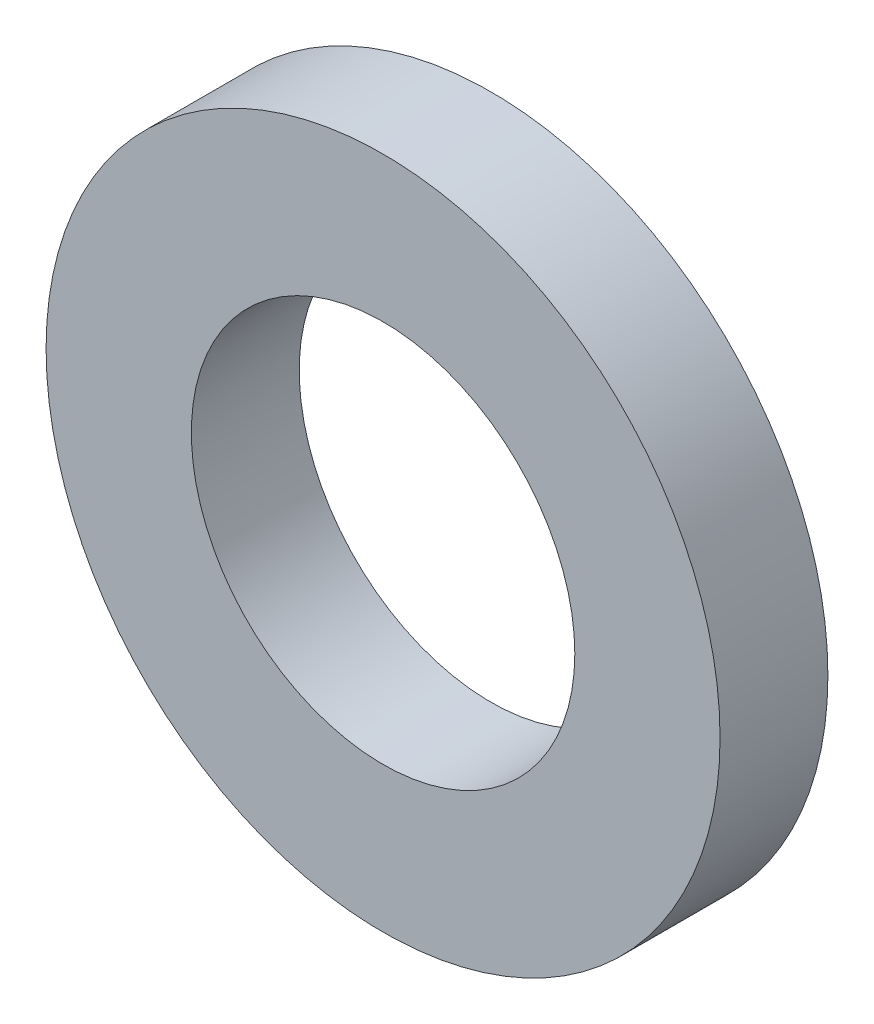
from build123d import *

# Parameters (mm, degrees)
SKETCH1_R           = 3.125
SKETCH1_R_2         = 1.778
BOSS_EXTRUDE1_DEPTH = 1


with BuildPart() as part:
    # Sketch1 → Boss-Extrude1 (new body)
    with BuildSketch(Plane.XY):
        Circle(SKETCH1_R)
        Circle(SKETCH1_R_2, mode=Mode.SUBTRACT)
    extrude(amount=BOSS_EXTRUDE1_DEPTH)


solid = part.part
